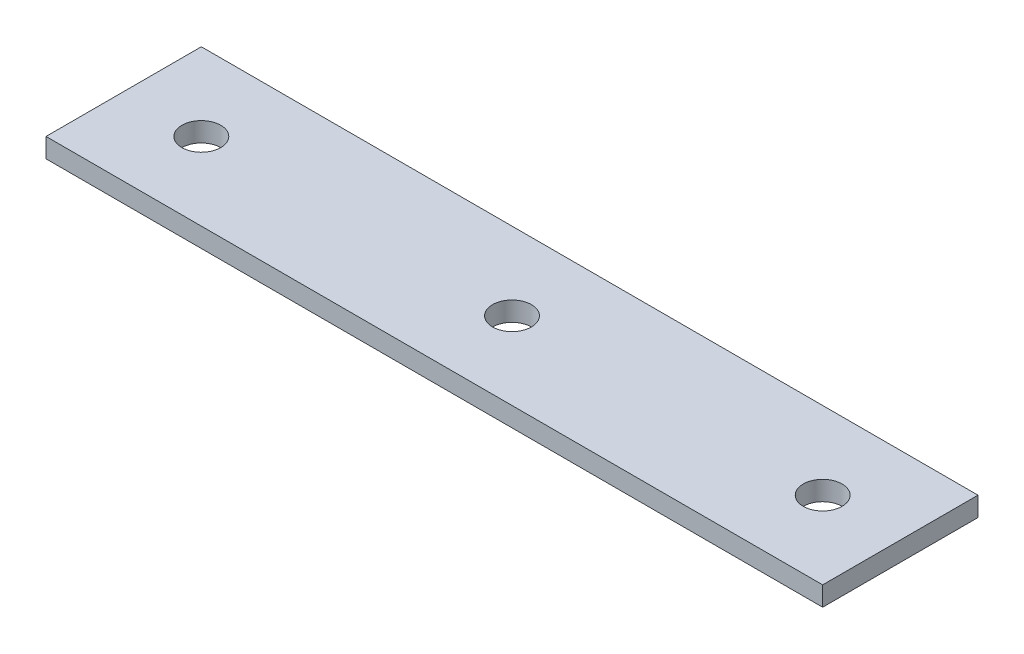
from build123d import *

# Parameters (mm, degrees)
SKETCH1_W           = 127
SKETCH1_H           = 25.4
BOSS_EXTRUDE1_DEPTH = 3.175
SKETCH2_R           = 3.175
CUT_EXTRUDE1_DEPTH  = 3.175


with BuildPart() as part:
    # Sketch1 → Boss-Extrude1 (new body)
    with BuildSketch(Plane(origin=(0, 0, 0), x_dir=(1, 0, 0), z_dir=(0, 1, 0))):
        with Locations((63.5, 12.7)):
            Rectangle(SKETCH1_W, SKETCH1_H)
    extrude(amount=BOSS_EXTRUDE1_DEPTH)

    # Sketch2 → Cut-Extrude1 (cut)
    with BuildSketch(Plane(origin=(0, 3.175, 0), x_dir=(1, 0, 0), z_dir=(0, 1, 0))):
        with Locations(Location((12.7, 12.7, 0), (0, 0, 270))):
            Circle(SKETCH2_R)
        with Locations(Location((114.3, 12.7, 0), (0, 0, 270))):
            Circle(SKETCH2_R)
        with Locations(Location((63.5, 12.7, 0), (0, 0, 270))):
            Circle(SKETCH2_R)
    extrude(amount=-CUT_EXTRUDE1_DEPTH, mode=Mode.SUBTRACT)


solid = part.part
